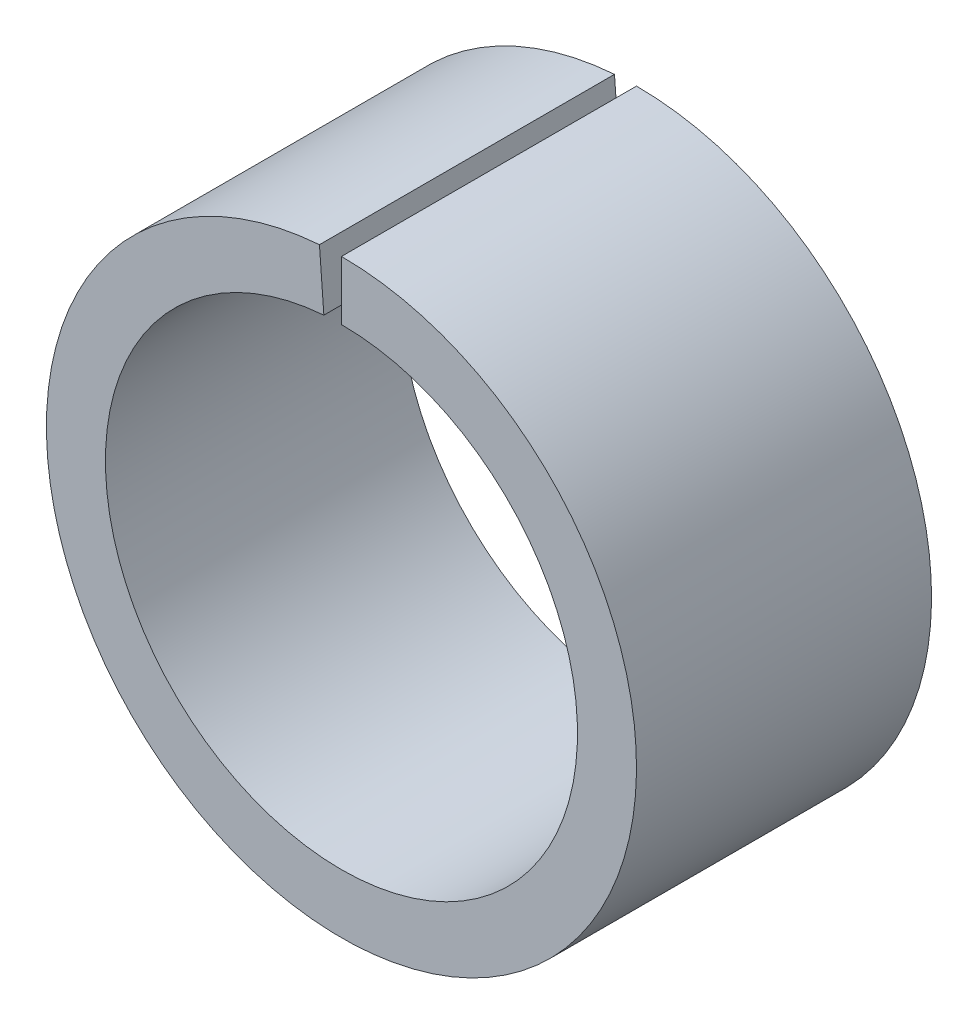
from build123d import *

# Parameters (mm, degrees)
SKETCH_1_R          = 5
SKETCH_1_R_2        = 4
EXTRUDE_1_DEPTH     = 5
CUT_EXTRUDE_1_DEPTH = 10


with BuildPart() as part:
    # 草图1 → 凸台-拉伸1 (new body)
    with BuildSketch(Plane.XY):
        Circle(SKETCH_1_R)
        Circle(SKETCH_1_R_2, mode=Mode.SUBTRACT)
    extrude(amount=EXTRUDE_1_DEPTH)

    # 草图2 → 切除-拉伸1 (cut)
    with BuildSketch(Plane.XY.offset(5)):
        Polygon((0, 0), (0, 10.777927296), (-0.806504289, 10.777927296), align=None)
    extrude(amount=-CUT_EXTRUDE_1_DEPTH, mode=Mode.SUBTRACT)


solid = part.part
